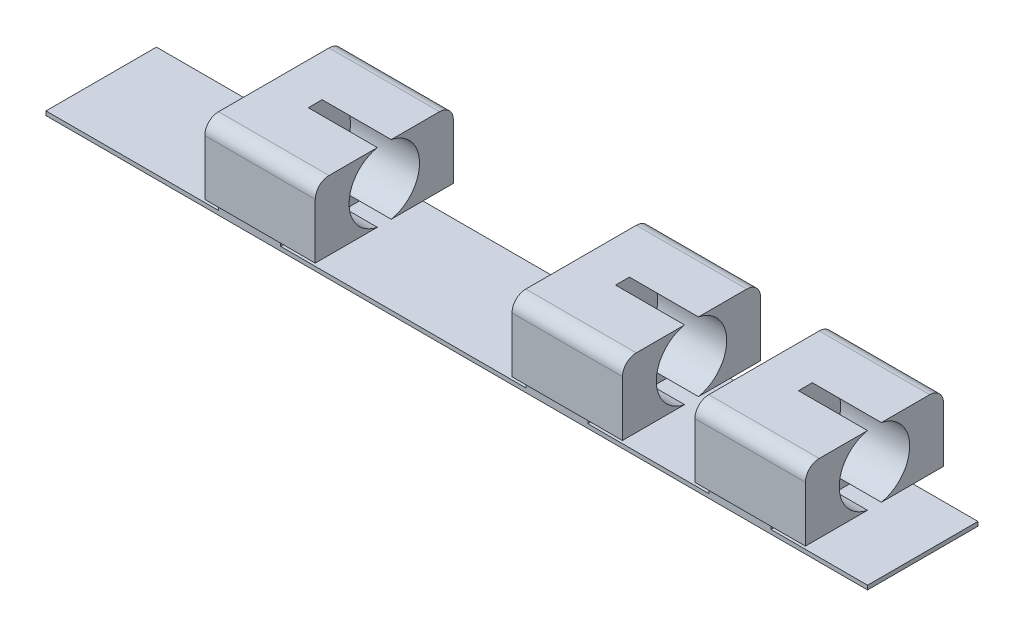
from build123d import *

# Parameters (mm, degrees)
BOSS_EXTRUDE1_DEPTH = 0.6
SKETCH3_W           = 9
SKETCH3_H           = 16
BOSS_EXTRUDE2_DEPTH = 2.4
SKETCH4_W           = 16
SKETCH4_H           = 20
BOSS_EXTRUDE3_DEPTH = 10
SKETCH5_R           = 5.1
CUT_EXTRUDE1_DEPTH  = 10
SKETCH6_R           = 5.1
CUT_EXTRUDE3_DEPTH  = 10
SKETCH7_R           = 5.1
CUT_EXTRUDE4_DEPTH  = 10
FILLET1_R           = 2
SKETCH8_W           = 2.2
SKETCH8_H           = 2.2
CUT_EXTRUDE5_DEPTH  = 3
SKETCH9_W           = 2.2
SKETCH9_H           = 2.2
CUT_EXTRUDE6_DEPTH  = 3
SKETCH10_W          = 2.2
SKETCH10_H          = 2.2
CUT_EXTRUDE7_DEPTH  = 3


with BuildPart() as part:
    # Sketch2 → Boss-Extrude1 (new body)
    with BuildSketch(Plane(origin=(0, 0, 0), x_dir=(1, 0, 0), z_dir=(0, 1, 0))):
        Polygon((-56, 8), (56, 8), (63, 8), (63, -8), (56, -8), (-56, -8), align=None)
    extrude(amount=-BOSS_EXTRUDE1_DEPTH)

    # Sketch3 → Boss-Extrude2 (add)
    with BuildSketch(Plane(origin=(0, 0, 0), x_dir=(1, 0, 0), z_dir=(0, 1, 0))):
        with Locations((44.5, 0)):
            Rectangle(SKETCH3_W, SKETCH3_H)
        with Locations((18, 0)):
            Rectangle(SKETCH3_W, SKETCH3_H)
        with Locations((-26.5, 0)):
            Rectangle(SKETCH3_W, SKETCH3_H)
    extrude(amount=BOSS_EXTRUDE2_DEPTH)

    # Sketch4 → Boss-Extrude3 (add)
    with BuildSketch(Plane(origin=(0, 2.4, 0), x_dir=(1, 0, 0), z_dir=(0, 1, 0))):
        with Locations((-23, 0)):
            Rectangle(SKETCH4_W, SKETCH4_H)
        with Locations((21.5, 0)):
            Rectangle(SKETCH4_W, SKETCH4_H)
        with Locations((48, 0)):
            Rectangle(SKETCH4_W, SKETCH4_H)
    extrude(amount=BOSS_EXTRUDE3_DEPTH)

    # Sketch5 → Cut-Extrude1 (cut)
    with BuildSketch(Plane(origin=(56, 0, 0), x_dir=(0, 0, -1), z_dir=(1, 0, 0))):
        with Locations((0, 7.4)):
            Circle(SKETCH5_R)
    extrude(amount=-CUT_EXTRUDE1_DEPTH, mode=Mode.SUBTRACT)

    # Sketch6 → Cut-Extrude3 (cut)
    with BuildSketch(Plane(origin=(29.5, 0, 0), x_dir=(0, 0, -1), z_dir=(1, 0, 0))):
        with Locations((0, 7.4)):
            Circle(SKETCH6_R)
    extrude(amount=-CUT_EXTRUDE3_DEPTH, mode=Mode.SUBTRACT)

    # Sketch7 → Cut-Extrude4 (cut)
    with BuildSketch(Plane(origin=(-15, 0, 0), x_dir=(0, 0, -1), z_dir=(1, 0, 0))):
        with Locations((0, 7.4)):
            Circle(SKETCH7_R)
    extrude(amount=-CUT_EXTRUDE4_DEPTH, mode=Mode.SUBTRACT)

    # Fillet1
    fillet1_edges = [part.edges().sort_by_distance(p)[0] for p in [
        (-23, 12.4, 10),
        (-23, 12.4, -10),
        (48, 12.4, 10),
        (48, 12.4, -10),
        (21.5, 12.4, 10),
        (21.5, 12.4, -10),
    ]]
    fillet(fillet1_edges, radius=FILLET1_R)

    # Sketch8 → Cut-Extrude5 (cut)
    with BuildSketch(Plane.ZY.offset(31)):
        with Locations((6, 7.4)):
            Rectangle(SKETCH8_W, SKETCH8_H)
        with Locations((-6, 7.4)):
            Rectangle(SKETCH8_W, SKETCH8_H)
    extrude(amount=-CUT_EXTRUDE5_DEPTH, mode=Mode.SUBTRACT)

    # Sketch9 → Cut-Extrude6 (cut)
    with BuildSketch(Plane(origin=(13.5, 0, -13.5), x_dir=(0, 0, 1), z_dir=(-1, 0, 0))):
        with Locations((19.5, 7.4)):
            Rectangle(SKETCH9_W, SKETCH9_H)
        with Locations((7.5, 7.4)):
            Rectangle(SKETCH9_W, SKETCH9_H)
    extrude(amount=-CUT_EXTRUDE6_DEPTH, mode=Mode.SUBTRACT)

    # Sketch10 → Cut-Extrude7 (cut)
    with BuildSketch(Plane(origin=(40, 0, -40), x_dir=(0, 0, 1), z_dir=(-1, 0, 0))):
        with Locations((46, 7.4)):
            Rectangle(SKETCH10_W, SKETCH10_H)
        with Locations((34, 7.4)):
            Rectangle(SKETCH10_W, SKETCH10_H)
    extrude(amount=-CUT_EXTRUDE7_DEPTH, mode=Mode.SUBTRACT)


solid = part.part
